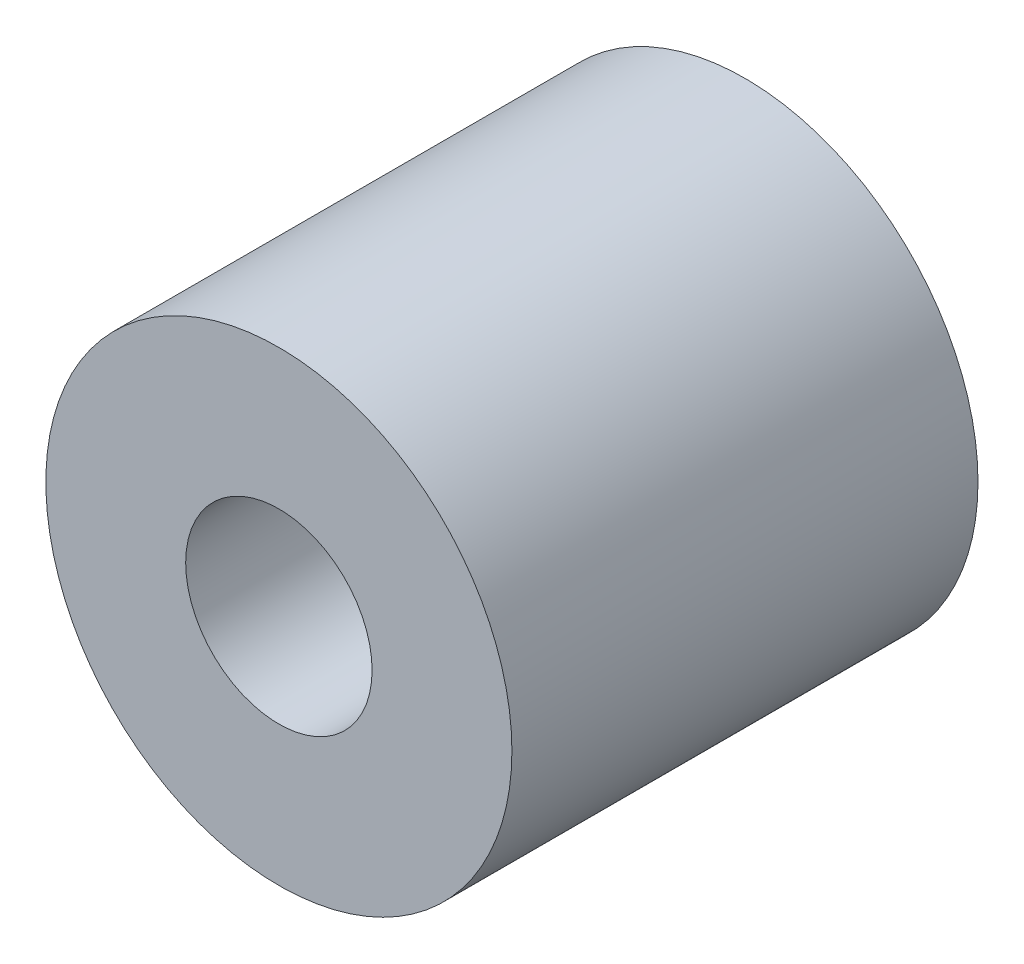
from build123d import *

# Parameters (mm, degrees)
SKETCH1_R           = 2.5
SKETCH1_R_2         = 1
BOSS_EXTRUDE1_DEPTH = 5


with BuildPart() as part:
    # Sketch1 → Boss-Extrude1 (new body)
    with BuildSketch(Plane.XY):
        Circle(SKETCH1_R)
        Circle(SKETCH1_R_2, mode=Mode.SUBTRACT)
    extrude(amount=BOSS_EXTRUDE1_DEPTH)


solid = part.part
